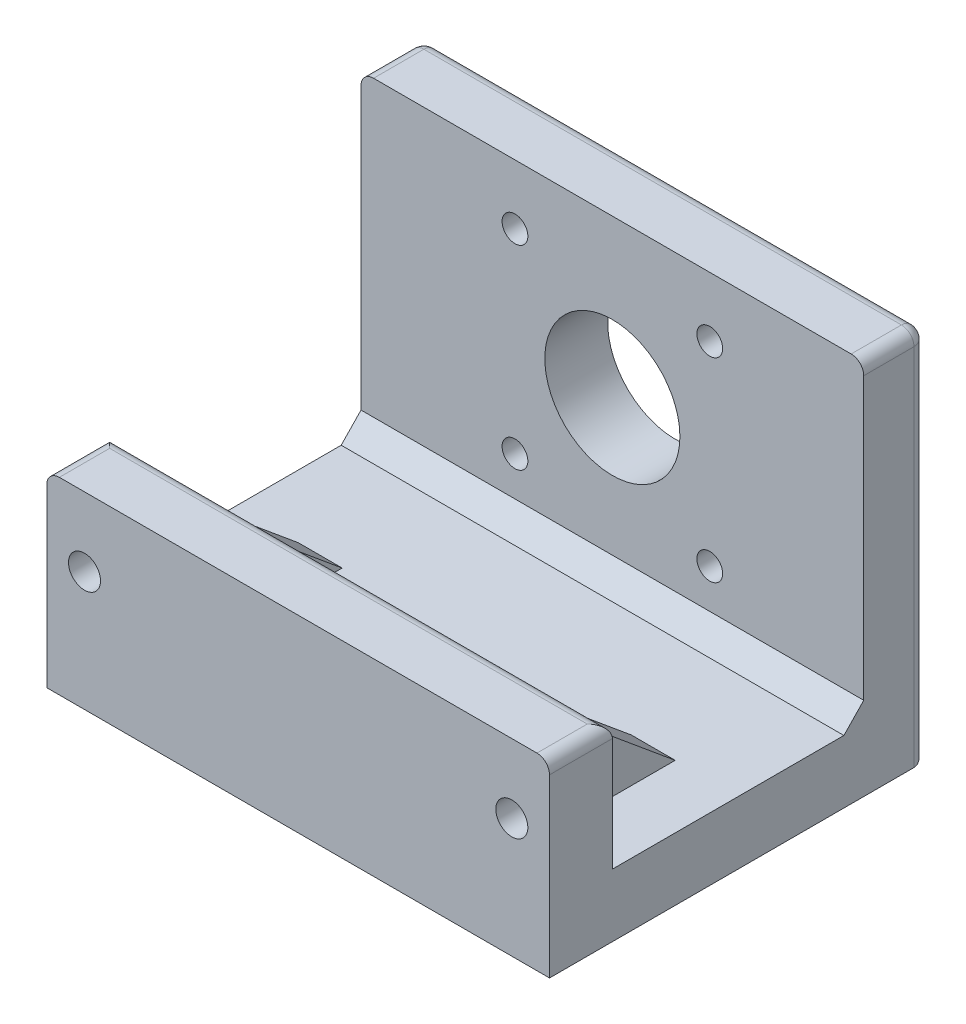
from build123d import *

# Parameters (mm, degrees)
SKETCH1_W                = 80
SKETCH1_H                = 60
BOSS_EXTRUDE1_DEPTH      = 60
SKETCH2_W                = 95.889864734
SKETCH2_H                = 40
CUT_EXTRUDE1_DEPTH       = 50
SKETCH3_W                = 80
SKETCH3_H                = 10
CUT_EXTRUDE2_DEPTH       = 30
SKETCH5_R                = 4.1
CUT_EXTRUDE3_DEPTH       = 7
SKETCH8_R                = 10.75
CUT_EXTRUDE5_DEPTH       = 88.749643874
SKETCH12_R               = 2.05
CUT_EXTRUDE8_DEPTH       = 88.749643874
FILLET1_R                = 2
SKETCH13_R               = 2.55
CUT_EXTRUDE9_DEPTH       = 88.749643874
SKETCH6_W                = 7
SKETCH6_H                = 16.599779926
BOSS_EXTRUDE2_DEPTH      = 20
CUT_EXTRUDE10_DEPTH      = 97.953597148
CUT_EXTRUDE10_DEPTH_BACK = 97.953597148
BOSS_EXTRUDE3_DEPTH      = 40


with BuildPart() as part:
    # Sketch1 → Boss-Extrude1 (new body)
    with BuildSketch(Plane(origin=(0, 0, 0), x_dir=(1, 0, 0), z_dir=(0, 1, 0))):
        Rectangle(SKETCH1_W, SKETCH1_H)
    extrude(amount=BOSS_EXTRUDE1_DEPTH)

    # Sketch2 → Cut-Extrude1 (cut)
    with BuildSketch(Plane(origin=(0, 60, 0), x_dir=(1, 0, 0), z_dir=(0, 1, 0))):
        Rectangle(SKETCH2_W, SKETCH2_H)
    extrude(amount=-CUT_EXTRUDE1_DEPTH, mode=Mode.SUBTRACT)

    # Sketch3 → Cut-Extrude2 (cut)
    with BuildSketch(Plane(origin=(0, 60, 0), x_dir=(1, 0, 0), z_dir=(0, 1, 0))):
        with Locations((0, -25)):
            Rectangle(SKETCH3_W, SKETCH3_H)
    extrude(amount=-CUT_EXTRUDE2_DEPTH, mode=Mode.SUBTRACT)

    # Sketch5 → Cut-Extrude3 (cut)
    with BuildSketch(Plane.XZ):
        with Locations(Location((-30, 0.5, 0), (0, 0, 270))):
            Circle(SKETCH5_R)
        with Locations(Location((30, 0.5, 0), (0, 0, 90))):
            Circle(SKETCH5_R)
    extrude(amount=-CUT_EXTRUDE3_DEPTH, mode=Mode.SUBTRACT)

    # Sketch8 → Cut-Extrude5 (cut, through all)
    with BuildSketch(Plane.XY.offset(-20)):
        with Locations((0, 35)):
            Circle(SKETCH8_R)
    extrude(amount=-CUT_EXTRUDE5_DEPTH, mode=Mode.SUBTRACT)

    # Sketch12 → Cut-Extrude8 (cut, through all)
    with BuildSketch(Plane.XY.offset(-20)):
        with Locations((15.5, 50.5)):
            Circle(SKETCH12_R)
        with Locations((-15.5, 19.5)):
            Circle(SKETCH12_R)
        with Locations((-15.5, 50.5)):
            Circle(SKETCH12_R)
        with Locations((15.5, 19.5)):
            Circle(SKETCH12_R)
    extrude(amount=-CUT_EXTRUDE8_DEPTH, mode=Mode.SUBTRACT)

    # Fillet1
    fillet1_edges = [part.edges().sort_by_distance(p)[0] for p in [
        (-40, 60, -25),
        (40, 60, -25),
        (-40, 30, 25),
        (0, 30, 20),
        (40, 30, 25),
        (0, 0, -30),
        (-40, 30, -30),
        (40, 30, -30),
        (0, 60, -30),
    ]]
    fillet(fillet1_edges, radius=FILLET1_R)

    # Sketch13 → Cut-Extrude9 (cut, through all)
    with BuildSketch(Plane(origin=(0, 0, 20), x_dir=(-1, 0, 0), z_dir=(0, 0, -1))):
        with Locations((-34, 19)):
            Circle(SKETCH13_R)
        with Locations((34, 19)):
            Circle(SKETCH13_R)
    extrude(amount=-CUT_EXTRUDE9_DEPTH, mode=Mode.SUBTRACT)

    # Sketch6 → Boss-Extrude2 (add)
    with BuildSketch(Plane(origin=(0, 0, 20), x_dir=(-1, 0, 0), z_dir=(0, 0, -1))):
        with Locations((-26.5, 18.299889963)):
            Rectangle(SKETCH6_W, SKETCH6_H)
        with Locations((26.5, 18.299889963)):
            Rectangle(SKETCH6_W, SKETCH6_H)
    extrude(amount=BOSS_EXTRUDE2_DEPTH)

    # Sketch14 → Cut-Extrude10 (cut, two sides: drawn at the far end of the back side and taken through both)
    with BuildSketch(Plane.ZY.offset(30).offset(-CUT_EXTRUDE10_DEPTH_BACK)):
        Polygon((0, 10), (20, 26.599779926), (0, 26.599779926), align=None)
    extrude(amount=CUT_EXTRUDE10_DEPTH + CUT_EXTRUDE10_DEPTH_BACK, mode=Mode.SUBTRACT)

    # Sketch15 → Boss-Extrude3 (add, symmetric)
    with BuildSketch(Plane(origin=(0, 0, 0), x_dir=(0, 0, -1), z_dir=(1, 0, 0))):
        Polygon((20, 13.27), (16.846771097, 10), (20, 10), align=None)
    extrude(amount=BOSS_EXTRUDE3_DEPTH, both=True)


solid = part.part
